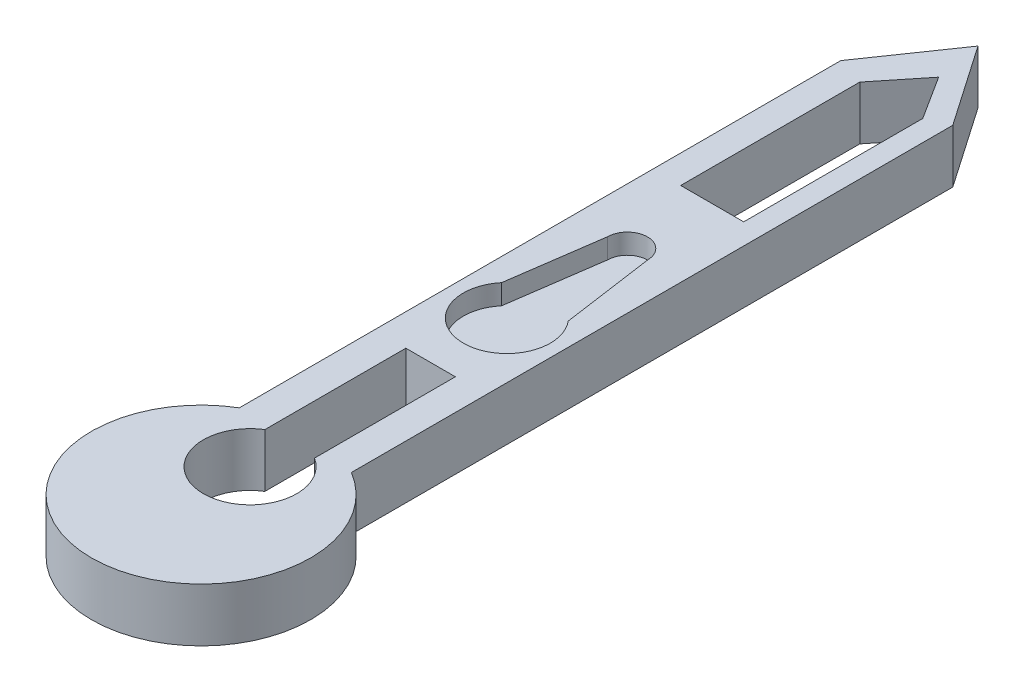
from build123d import *

# Parameters (mm, degrees)
SKETCH2_R           = 16.37540157
SKETCH2_W           = 30
SKETCH2_H           = 50
SKETCH2_W_2         = 16.72757971
SKETCH2_H_2         = 91.338041812
BOSS_EXTRUDE1_DEPTH = 8
CUT_EXTRUDE1_DEPTH  = 3
SKETCH7_W           = 21
SKETCH7_H           = 41
SKETCH7_W_2         = 7
SKETCH7_H_2         = 18
CUT_EXTRUDE2_DEPTH  = 97.732382254
SKETCH8_W           = 42.713825064
SKETCH8_H           = 72.244370788
CUT_EXTRUDE3_DEPTH  = 97.732382254
SKETCH10_W          = 16.72757971
SKETCH10_H          = 8
BOSS_EXTRUDE3_DEPTH = 43
CUT_EXTRUDE4_DEPTH  = 23
SKETCH12_W          = 9.409731529
SKETCH12_H          = 26.743509799
SKETCH12_W_2        = 7.397521328
SKETCH12_H_2        = 21.048617388
CUT_EXTRUDE5_DEPTH  = 10


with BuildPart() as part:
    # Sketch2 → Boss-Extrude1 (new body)
    with BuildSketch(Plane(origin=(0, 0, 0), x_dir=(1, 0, 0), z_dir=(0, 1, 0))):
        with Locations((0, -45.669020906)):
            Circle(SKETCH2_R)
        with Locations((0, 70)):
            Rectangle(SKETCH2_W, SKETCH2_H)
        Rectangle(SKETCH2_W_2, SKETCH2_H_2)
    extrude(amount=BOSS_EXTRUDE1_DEPTH)

    # Sketch6 → Cut-Extrude1 (cut)
    with BuildSketch(Plane(origin=(0, 8, 0), x_dir=(1, 0, 0), z_dir=(0, 1, 0))):
        with BuildLine():
            Line((-2.999771067, 18.037061373), (-4.97435622, 4.183990942))
            ThreePointArc((-4.97435622, 4.183990942), (0, -6.5), (4.97435622, 4.183990942))
            Line((4.97435622, 4.183990942), (2.999771067, 18.037061373))
            ThreePointArc((2.999771067, 18.037061373), (0, 21), (-2.999771067, 18.037061373))
        make_face()
    extrude(amount=-CUT_EXTRUDE1_DEPTH, mode=Mode.SUBTRACT)

    # Sketch7 → Cut-Extrude2 (cut, through all)
    with BuildSketch(Plane.XZ):
        with Locations((0, -70)):
            Rectangle(SKETCH7_W, SKETCH7_H)
        with Locations((0, -49.5)):
            Rectangle(SKETCH7_W_2, SKETCH7_H_2)
    extrude(amount=-CUT_EXTRUDE2_DEPTH, mode=Mode.SUBTRACT)

    # Sketch8 → Cut-Extrude3 (cut, through all)
    with BuildSketch(Plane.XZ):
        with Locations((-1.974672585, -63.480825527)):
            Rectangle(SKETCH8_W, SKETCH8_H)
    extrude(amount=-CUT_EXTRUDE3_DEPTH, mode=Mode.SUBTRACT)

    # Sketch10 → Boss-Extrude3 (add)
    with BuildSketch(Plane(origin=(0, 0, -27.358640133), x_dir=(-1, 0, 0), z_dir=(0, 0, -1))):
        with Locations((0, 4)):
            Rectangle(SKETCH10_W, SKETCH10_H)
    extrude(amount=BOSS_EXTRUDE3_DEPTH)

    # Sketch11 → Cut-Extrude4 (cut)
    with BuildSketch(Plane.XZ):
        Polygon((-8.363789855, -58.228971018), (0, -70.358640133), (8.363789855, -58.228971018), (14.634786806, -58.228971018), (14.634786806, -78.124340067), (-16.486460869, -78.124340067), (-15.81957699, -58.228971018), align=None)
    extrude(amount=-CUT_EXTRUDE4_DEPTH, mode=Mode.SUBTRACT)

    # Sketch12 → Cut-Extrude5 (cut)
    with BuildSketch(Plane(origin=(0, 8, 0), x_dir=(1, 0, 0), z_dir=(0, 1, 0))):
        with Locations((0.538728684, 43.496138516)):
            Rectangle(SKETCH12_W, SKETCH12_H)
        with Locations((0.054120037, -21.966665665)):
            Rectangle(SKETCH12_W_2, SKETCH12_H_2)
        with BuildLine():
            ThreePointArc((3.752880701, -32.490974359), (0.054120037, -45.382739126), (-3.644640627, -32.490974359))
            Line((-3.644640627, -32.490974359), (3.752880701, -32.490974359))
        make_face()
        Polygon((5.243594448, 56.867893415), (1.087937996, 63.395652597), (-4.166137081, 56.867893415), align=None)
    extrude(amount=-CUT_EXTRUDE5_DEPTH, mode=Mode.SUBTRACT)


solid = part.part
